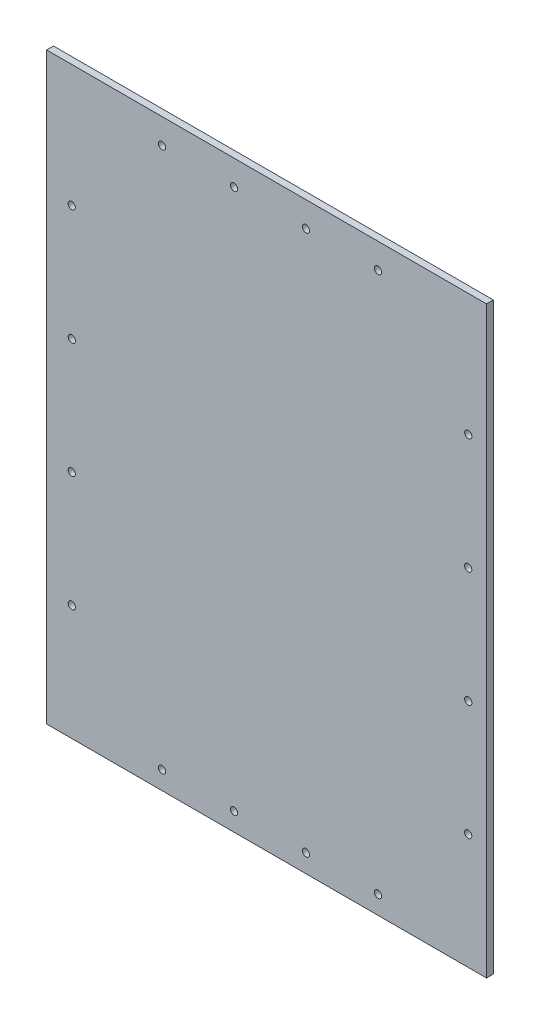
from build123d import *

# Parameters (mm, degrees)
SKETCH_1_W          = 305.55
SKETCH_1_H          = 405.55
EXTRUDE_1_DEPTH     = 4.75
SKETCH_3_R          = 2.5
CUT_EXTRUDE_1_DEPTH = 10
SKETCH_5_R          = 2.5
CUT_EXTRUDE_3_DEPTH = 10
SKETCH_6_R          = 2.5
CUT_EXTRUDE_4_DEPTH = 10
SKETCH_7_R          = 2.5
CUT_EXTRUDE_5_DEPTH = 10


with BuildPart() as part:
    # 草圖1 → 填料-伸長1 (new body)
    with BuildSketch(Plane.XY):
        Rectangle(SKETCH_1_W, SKETCH_1_H)
    extrude(amount=EXTRUDE_1_DEPTH)

    # 草圖3 → 除料-伸長1 (cut)
    with BuildSketch(Plane.XY.offset(4.75)):
        with Locations((140.075, 37.705)):
            Circle(SKETCH_3_R)
        with Locations((140.075, 117.865)):
            Circle(SKETCH_3_R)
        with Locations((140.075, -42.455)):
            Circle(SKETCH_3_R)
        with Locations((140.075, -122.615)):
            Circle(SKETCH_3_R)
    extrude(amount=-CUT_EXTRUDE_1_DEPTH, mode=Mode.SUBTRACT)

    # 草圖5 → 除料-伸長3 (cut)
    with BuildSketch(Plane.XY.offset(4.75)):
        with Locations((-135.325, -122.615)):
            Circle(SKETCH_5_R)
        with Locations((-135.325, -42.455)):
            Circle(SKETCH_5_R)
        with Locations((-135.325, 37.705)):
            Circle(SKETCH_5_R)
        with Locations((-135.325, 117.865)):
            Circle(SKETCH_5_R)
    extrude(amount=-CUT_EXTRUDE_3_DEPTH, mode=Mode.SUBTRACT)

    # 草圖6 → 除料-伸長4 (cut)
    with BuildSketch(Plane(origin=(0, 0, 0), x_dir=(-1, 0, 0), z_dir=(0, 0, -1))):
        with Locations((22.625, 185.325)):
            Circle(SKETCH_6_R)
        with Locations((72.625, 185.325)):
            Circle(SKETCH_6_R)
        with Locations((-77.375, 185.325)):
            Circle(SKETCH_6_R)
        with Locations((-27.375, 185.325)):
            Circle(SKETCH_6_R)
    extrude(amount=-CUT_EXTRUDE_4_DEPTH, mode=Mode.SUBTRACT)

    # 草圖7 → 除料-伸長5 (cut)
    with BuildSketch(Plane(origin=(0, 0, 0), x_dir=(-1, 0, 0), z_dir=(0, 0, -1))):
        with Locations((-77.375, -190.075)):
            Circle(SKETCH_7_R)
        with Locations((-27.375, -190.075)):
            Circle(SKETCH_7_R)
        with Locations((22.625, -190.075)):
            Circle(SKETCH_7_R)
        with Locations((72.625, -190.075)):
            Circle(SKETCH_7_R)
    extrude(amount=-CUT_EXTRUDE_5_DEPTH, mode=Mode.SUBTRACT)


solid = part.part
